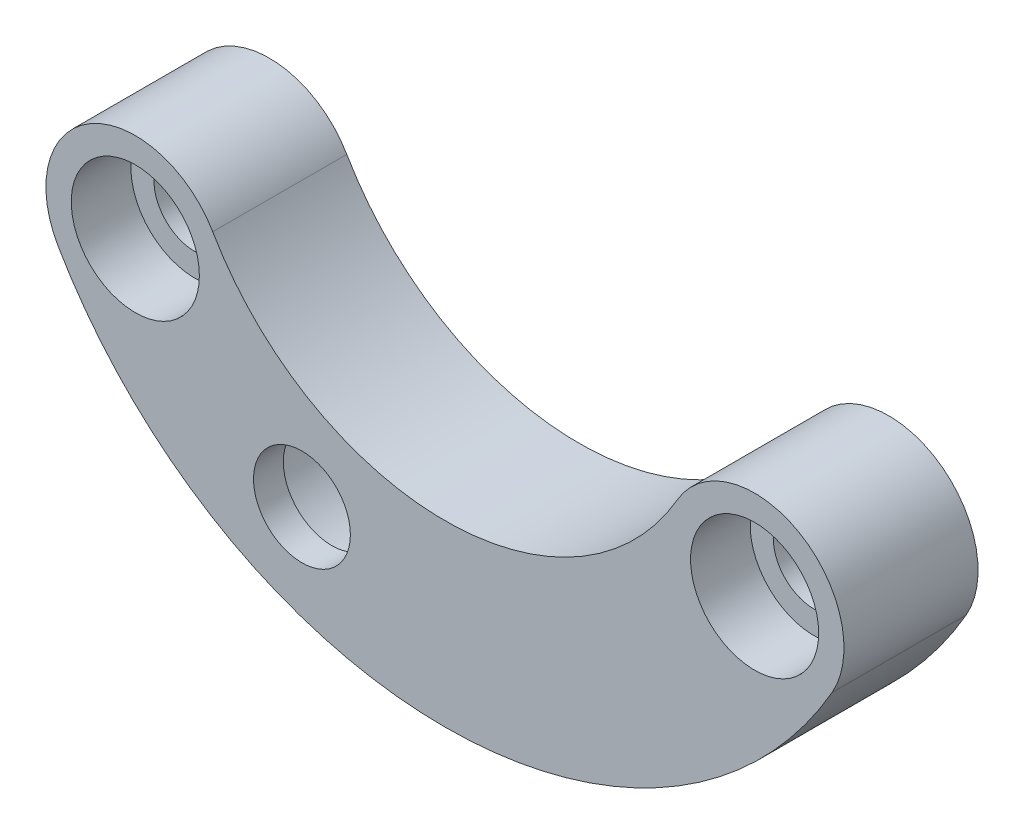
from build123d import *

# Parameters (mm, degrees)
ESBO_O1_R                = 1.375
RESSALTO_EXTRUS_O3_DEPTH = 4.5
ESBO_O7_R                = 1.625
CORTE_EXTRUS_O4_DEPTH    = 21.605917331
ESBO_O8_R                = 2.15
CORTE_EXTRUS_O5_DEPTH    = 2
ESBO_O9_R                = 2.9
CORTE_EXTRUS_O6_DEPTH    = 3.5


with BuildPart() as part:
    # Esboço1 → Ressalto-extrusão3 (new body)
    with BuildSketch(Plane.XY):
        with BuildLine():
            ThreePointArc((-7.794228634, -4.5), (-11.892304845, -3.401923789), (-12.990381057, -7.5))
            ThreePointArc((-12.990381057, -7.5), (0, -15), (12.990381057, -7.5))
            ThreePointArc((12.990381057, -7.5), (11.892304845, -3.401923789), (7.794228634, -4.5))
            ThreePointArc((7.794228634, -4.5), (0, -9), (-7.794228634, -4.5))
        make_face()
        with Locations((-10.392304845, -6)):
            Circle(ESBO_O1_R, mode=Mode.SUBTRACT)
        with Locations(Location((10.392304845, -6, 0), (0, 0, 180))):
            Circle(ESBO_O1_R, mode=Mode.SUBTRACT)
    extrude(amount=RESSALTO_EXTRUS_O3_DEPTH)

    # Esboço7 → Corte-extrusão4 (cut, through all)
    with BuildSketch(Plane.XY.offset(4.5)):
        with Locations((-4.8, -10.998181668)):
            Circle(ESBO_O7_R)
    extrude(amount=-CORTE_EXTRUS_O4_DEPTH, mode=Mode.SUBTRACT)

    # Esboço8 → Corte-extrusão5 (cut)
    with BuildSketch(Plane.XY.offset(4.5)):
        with Locations((-10.392304845, -6)):
            Circle(ESBO_O8_R)
        with Locations((10.392304845, -6)):
            Circle(ESBO_O8_R)
    extrude(amount=-CORTE_EXTRUS_O5_DEPTH, mode=Mode.SUBTRACT)

    # Esboço9 → Corte-extrusão6 (cut)
    with BuildSketch(Plane(origin=(0, 0, 0), x_dir=(-1, 0, 0), z_dir=(0, 0, -1))):
        with Locations((4.8, -10.998181668)):
            Circle(ESBO_O9_R)
    extrude(amount=-CORTE_EXTRUS_O6_DEPTH, mode=Mode.SUBTRACT)


solid = part.part
